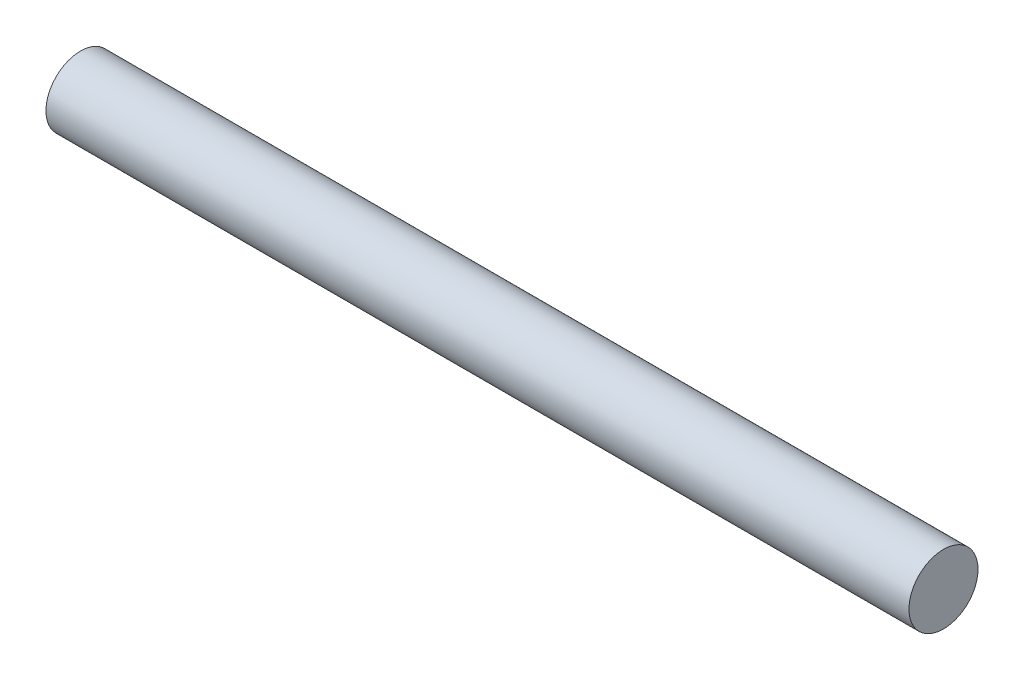
from build123d import *

# Parameters (mm, degrees)
SKIZZE1_R                       = 4
AUFSATZ_LINEAR_AUSTRAGEN1_DEPTH = 100
SKIZZE2_R                       = 1.65
SCHNITT_LINEAR_AUSTRAGEN1_DEPTH = 4


with BuildPart() as part:
    # Skizze1 → Aufsatz-Linear austragen1 (new body)
    with BuildSketch(Plane(origin=(0, 0, 0), x_dir=(0, 0, -1), z_dir=(1, 0, 0))):
        Circle(SKIZZE1_R)
    extrude(amount=AUFSATZ_LINEAR_AUSTRAGEN1_DEPTH)

    # Skizze2 → Schnitt-Linear austragen1 (cut)
    with BuildSketch(Plane.ZY):
        Circle(SKIZZE2_R)
    extrude(amount=-SCHNITT_LINEAR_AUSTRAGEN1_DEPTH, mode=Mode.SUBTRACT)


solid = part.part
